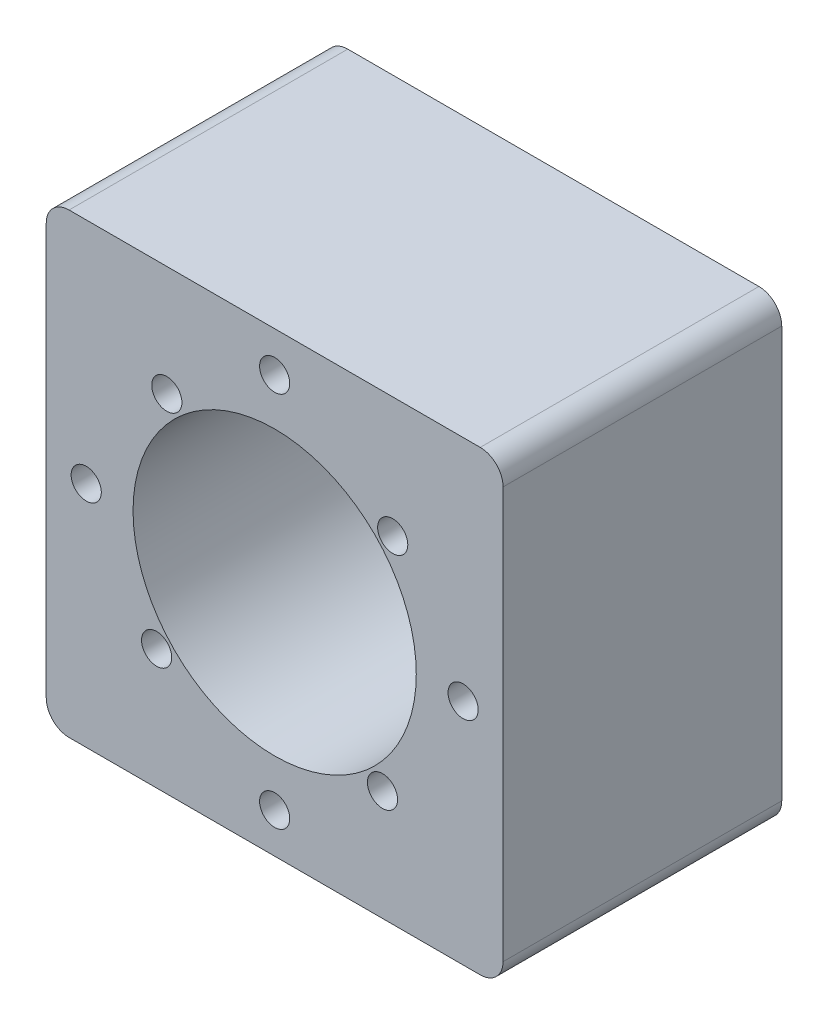
from build123d import *

# Parameters (mm, degrees)
ESQUISSE1_R                                        = 50
BOSS_EXTRU_1_DEPTH                                 = 61
ESQUISSE2_R                                        = 31
ENL_V_MAT_EXTRU_1_DEPTH                            = 72
CHAMBRAGE_POUR_VIS_T_TE_RONDE_BOMB_E_M_D           = 6.6
CHAMBRAGE_POUR_VIS_T_TE_RONDE_BOMB_E_M_CBORE_D     = 13
CHAMBRAGE_POUR_VIS_T_TE_RONDE_BOMB_E_M_CBORE_DEPTH = 4.6
D_GAGEMENT_M61_D                                   = 6.6
D_GAGEMENT_M61_DEPTH                               = 5
D_GAGEMENT_M61_TIP                                 = 1.905255888
BOSS_EXTRU_2_START                                 = -61
BOSS_EXTRU_2_DEPTH                                 = 61
ESQUISSE23_R                                       = 31
ESQUISSE23_R_2                                     = 25
BOSS_EXTRU_3_DEPTH                                 = 7
ESQUISSE24_R                                       = 31
ENL_V_MAT_EXTRU_2_DEPTH                            = 3


with BuildPart() as part:
    # Esquisse1 → Boss.-Extru.1 (new body)
    with BuildSketch(Plane.XY):
        with Locations(Location((0, 0, 0), (0, 0, 180))):
            Circle(ESQUISSE1_R)
    extrude(amount=BOSS_EXTRU_1_DEPTH)

    # Esquisse2 → Enlèv. mat.-Extru.1 (cut)
    with BuildSketch(Plane(origin=(0, 0, 0), x_dir=(-1, 0, 0), z_dir=(0, 0, -1))):
        Circle(ESQUISSE2_R)
    extrude(amount=-ENL_V_MAT_EXTRU_1_DEPTH, mode=Mode.SUBTRACT)

    # Chambrage pour vis à tête ronde bombée M61 (through all)
    with Locations(Plane(origin=(0, 0, 0), x_dir=(-1, 0, 0), z_dir=(0, 0, -1))):
        with Locations((41.25, 0), (0, 41.25), (-41.25, 0), (0, -41.25)):
            CounterBoreHole(CHAMBRAGE_POUR_VIS_T_TE_RONDE_BOMB_E_M_D / 2, CHAMBRAGE_POUR_VIS_T_TE_RONDE_BOMB_E_M_CBORE_D / 2, CHAMBRAGE_POUR_VIS_T_TE_RONDE_BOMB_E_M_CBORE_DEPTH)

    # Dégagement M61
    with Locations(Plane.XY.offset(61)):
        with Locations((-23.608593004, 25.838621023), (-25.838621023, -23.608593004), (23.608593004, -25.838621023), (25.838621023, 23.608593004)):
            Hole(D_GAGEMENT_M61_D / 2, depth=D_GAGEMENT_M61_DEPTH)
            with Locations((0, 0, -(D_GAGEMENT_M61_DEPTH + D_GAGEMENT_M61_TIP / 2))):  # 120° drill point
                Cone(0, D_GAGEMENT_M61_D / 2, D_GAGEMENT_M61_TIP, mode=Mode.SUBTRACT)

    # Esquisse20 → Boss.-Extru.2 (add)
    with BuildSketch(Plane(origin=(0, 0, 0), x_dir=(-1, 0, 0), z_dir=(0, 0, -1)).offset(BOSS_EXTRU_2_START)):
        with BuildLine():
            ThreePointArc((-50, -45), (-48.535533906, -48.535533906), (-45, -50))
            Line((-45, -50), (0, -50))
            ThreePointArc((0, -50), (-35.35533911, -35.355339009), (-50, 1.43e-07))
            Line((-50, 1.43e-07), (-50, -45))
        make_face()
        with BuildLine():
            ThreePointArc((50, 0), (35.355339059, -35.355339059), (0, -50))
            Line((0, -50), (45, -50))
            ThreePointArc((45, -50), (48.535533906, -48.535533906), (50, -45))
            Line((50, -45), (50, 0))
        make_face()
        with BuildLine():
            Line((-50, 45), (-50, 1.43e-07))
            ThreePointArc((-50, 1.43e-07), (-35.355339046, 35.355339073), (-1.05e-07, 50))
            Line((-1.05e-07, 50), (-45, 50))
            ThreePointArc((-45, 50), (-48.535533906, 48.535533906), (-50, 45))
        make_face()
        with BuildLine():
            ThreePointArc((-1.05e-07, 50), (35.355339022, 35.355339097), (50, 0))
            Line((50, 0), (50, 45))
            ThreePointArc((50, 45), (48.535533906, 48.535533906), (45, 50))
            Line((45, 50), (-1.05e-07, 50))
        make_face()
    extrude(amount=BOSS_EXTRU_2_DEPTH)

    # Esquisse23 → Boss.-Extru.3 (add)
    with BuildSketch(Plane(origin=(0, 0, 0), x_dir=(-1, 0, 0), z_dir=(0, 0, -1))):
        Circle(ESQUISSE23_R)
        Circle(ESQUISSE23_R_2, mode=Mode.SUBTRACT)
    extrude(amount=-BOSS_EXTRU_3_DEPTH)

    # Esquisse24 → Enlèv. mat.-Extru.2 (cut)
    with BuildSketch(Plane(origin=(0, 0, 0), x_dir=(-1, 0, 0), z_dir=(0, 0, -1))):
        Circle(ESQUISSE24_R)
    extrude(amount=-ENL_V_MAT_EXTRU_2_DEPTH, mode=Mode.SUBTRACT)


solid = part.part
